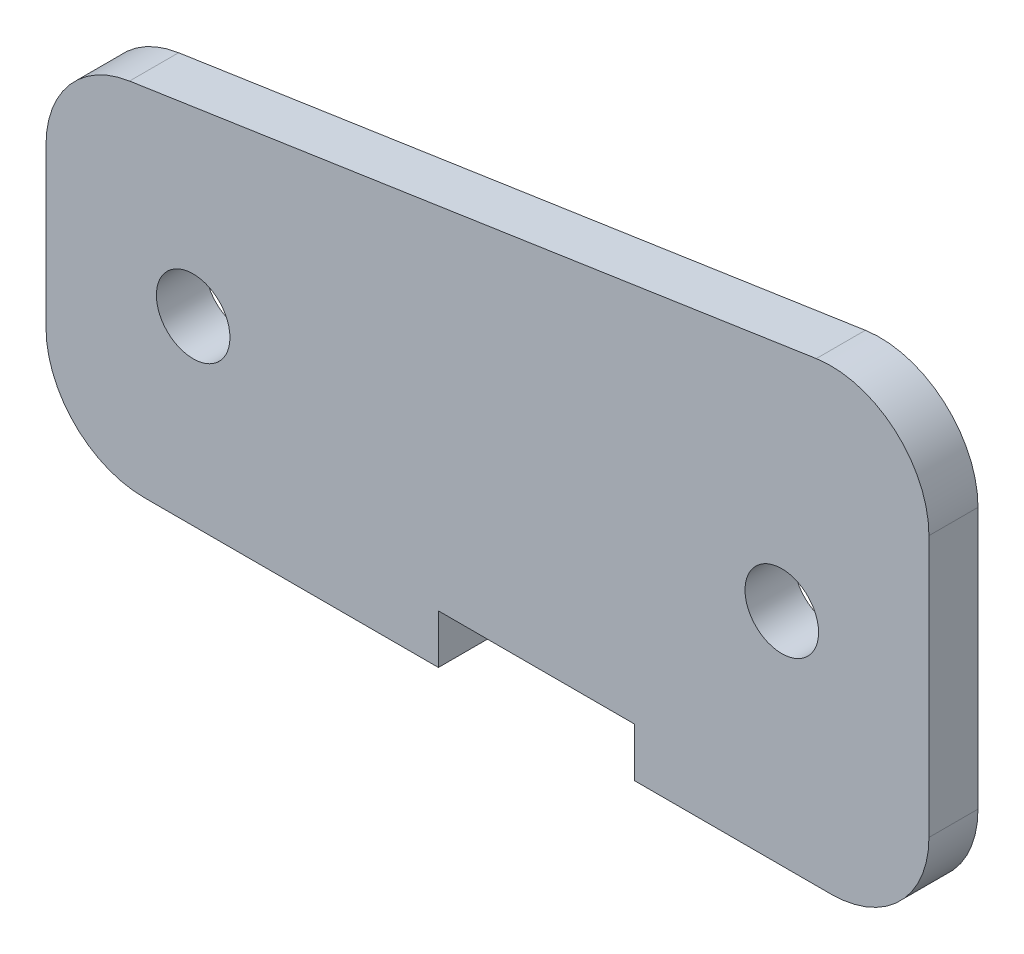
from build123d import *

# Parameters (mm, degrees)
BOSS_EXTRUDE1_DEPTH = 3.175


with BuildPart() as part:
    # Sketch1 → Boss-Extrude1 (new body)
    with BuildSketch(Plane.XY):
        with BuildLine():
            Line((-266.475505146, 24.162932081), (-270.592467022, 23.5453878))
            ThreePointArc((-270.592467022, 23.5453878), (-274.462155482, 21.409374702), (-276.000505146, 17.265641959))
            Line((-276.000505146, 17.265641959), (-276.000505146, 7.017932081))
            ThreePointArc((-276.000505146, 7.017932081), (-274.140633206, 2.527804021), (-269.650505146, 0.667932081))
            Line((-269.650505146, 0.667932081), (-266.475505146, 0.667932081))
            Line((-266.475505146, 0.667932081), (-266.475505146, 10.034182081))
            ThreePointArc((-266.475505146, 10.034182081), (-268.856755146, 12.415432081), (-266.475505146, 14.796682081))
            Line((-266.475505146, 14.796682081), (-266.475505146, 24.162932081))
        make_face()
        with BuildLine():
            Line((-228.375505146, 29.877932081), (-266.475505146, 24.162932081))
            Line((-266.475505146, 24.162932081), (-266.475505146, 14.796682081))
            ThreePointArc((-266.475505146, 14.796682081), (-264.791707123, 14.099230104), (-264.094255146, 12.415432081))
            ThreePointArc((-264.094255146, 12.415432081), (-264.791707123, 10.731634059), (-266.475505146, 10.034182081))
            Line((-266.475505146, 10.034182081), (-266.475505146, 0.667932081))
            Line((-266.475505146, 0.667932081), (-250.600505146, 0.667932081))
            Line((-250.600505146, 0.667932081), (-250.600505146, 3.842932081))
            Line((-250.600505146, 3.842932081), (-237.900505146, 3.842932081))
            Line((-237.900505146, 3.842932081), (-237.900505146, 0.667932081))
            Line((-237.900505146, 0.667932081), (-228.375505146, 0.667932081))
            Line((-228.375505146, 0.667932081), (-228.375505146, 12.557716041))
            ThreePointArc((-228.375505146, 12.557716041), (-230.756755146, 14.938966041), (-228.375505146, 17.320216041))
            Line((-228.375505146, 17.320216041), (-228.375505146, 29.877932081))
        make_face()
        with BuildLine():
            Line((-226.142467022, 30.2128878), (-228.375505146, 29.877932081))
            Line((-228.375505146, 29.877932081), (-228.375505146, 17.320216041))
            ThreePointArc((-228.375505146, 17.320216041), (-226.691707123, 16.622764063), (-225.994255146, 14.938966041))
            ThreePointArc((-225.994255146, 14.938966041), (-226.691707123, 13.255168018), (-228.375505146, 12.557716041))
            Line((-228.375505146, 12.557716041), (-228.375505146, 0.667932081))
            Line((-228.375505146, 0.667932081), (-225.200505146, 0.667932081))
            ThreePointArc((-225.200505146, 0.667932081), (-220.710377085, 2.527804021), (-218.850505146, 7.017932081))
            Line((-218.850505146, 7.017932081), (-218.850505146, 23.933141959))
            ThreePointArc((-218.850505146, 23.933141959), (-221.056772403, 28.744792295), (-226.142467022, 30.2128878))
        make_face()
    extrude(amount=BOSS_EXTRUDE1_DEPTH)


solid = part.part
